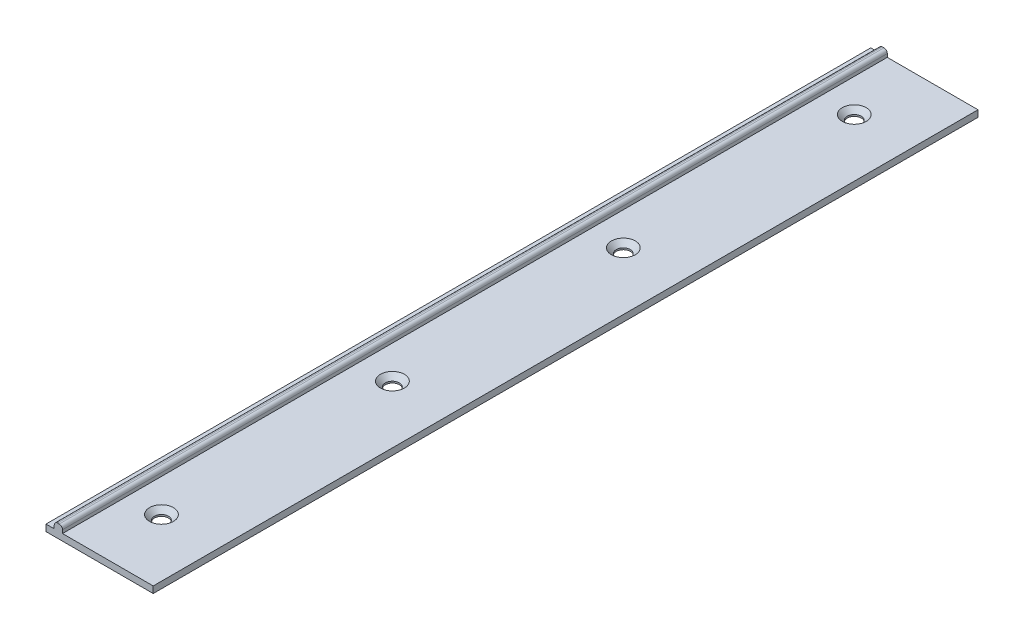
from build123d import *

# Parameters (mm, degrees)
Y_KSEKLIK_EKSTR_ZYON1_DEPTH = 500
RADYUS1_R                   = 2
IZIM2_R                     = 4.25
KES_EKSTR_ZYON1_DEPTH       = 10
PAH1_SIZE                   = 3


with BuildPart() as part:
    # Çizim1 → Yükseklik-Ekstrüzyon1 (new body)
    with BuildSketch(Plane.XY):
        Polygon((0, 0), (65, 0), (65, 4), (10, 4), (10, 8), (5, 8), (5, 4), (0, 4), align=None)
    extrude(amount=-Y_KSEKLIK_EKSTR_ZYON1_DEPTH)

    # Radyus1
    radyus1_edges = [part.edges().sort_by_distance(p)[0] for p in [
        (5, 8, -250),
        (10, 8, -250),
    ]]
    fillet(radyus1_edges, radius=RADYUS1_R)

    # Çizim2 → Kes-Ekstrüzyon1 (cut)
    with BuildSketch(Plane.XZ):
        with Locations(Location((30, -40, 0), (0, 0, 270))):
            Circle(IZIM2_R)
        with Locations(Location((30, -180, 0), (0, 0, 270))):
            Circle(IZIM2_R)
        with Locations(Location((30, -320, 0), (0, 0, 270))):
            Circle(IZIM2_R)
        with Locations(Location((30, -460, 0), (0, 0, 270))):
            Circle(IZIM2_R)
    extrude(amount=-KES_EKSTR_ZYON1_DEPTH, mode=Mode.SUBTRACT)

    # Pah1
    pah1_edges = [part.edges().sort_by_distance(p)[0] for p in [
        (30, 4, -35.75),
        (30, 4, -175.75),
        (30, 4, -315.75),
        (30, 4, -455.75),
    ]]
    chamfer(pah1_edges, length=PAH1_SIZE)


solid = part.part
